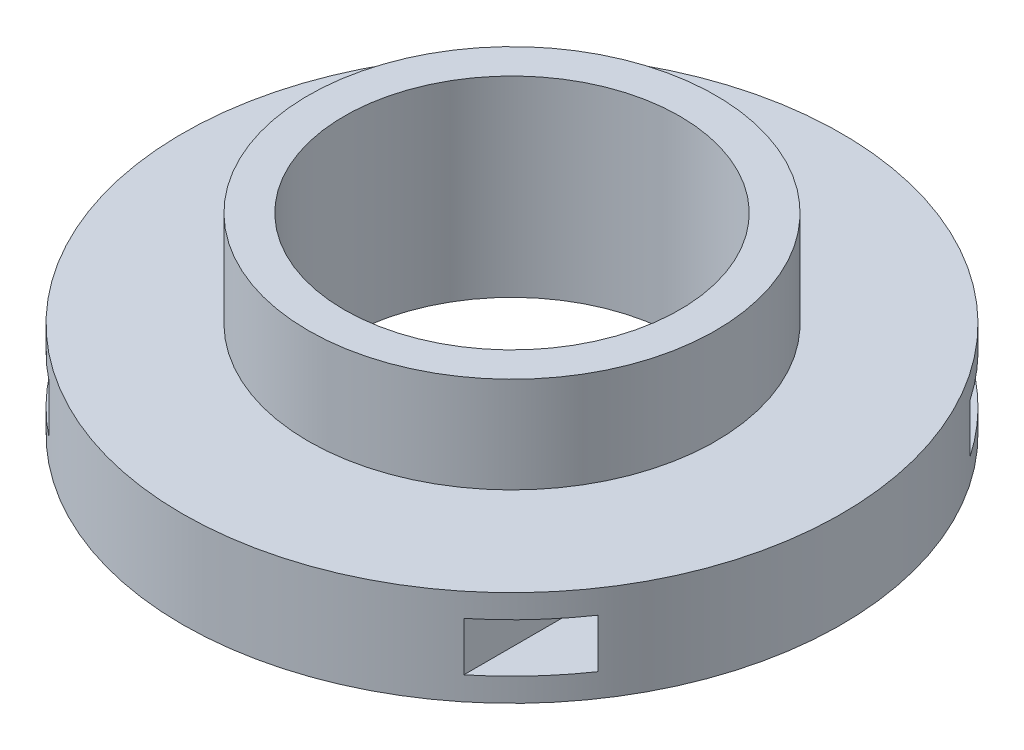
from build123d import *

# Parameters (mm, degrees)
SKETCH1_R               = 13.75
BOSS_EXTRUDE1_DEPTH     = 4
BOSS_EXTRUDE2_START     = 4
SKETCH5_R               = 8.5
BOSS_EXTRUDE2_DEPTH     = 4
CUT_EXTRUDE1_DEPTH      = 22.026768653
CUT_EXTRUDE1_DEPTH_BACK = 22.026768653
SKETCH6_W               = 2.888681075
SKETCH6_H               = 2.039823556
SKETCH6_W_2             = 2.682346713
SKETCH8_R               = 7
CUT_EXTRUDE3_DEPTH      = 12


with BuildPart() as part:
    # Sketch1 → Boss-Extrude1 (new body)
    with BuildSketch(Plane(origin=(0, 0, 0), x_dir=(1, 0, 0), z_dir=(0, 1, 0))):
        with Locations(Location((0, 0, 0), (0, 0, 270))):
            Circle(SKETCH1_R)
    extrude(amount=BOSS_EXTRUDE1_DEPTH)

    # Sketch5 → Boss-Extrude2 (add)
    with BuildSketch(Plane(origin=(0, 0, 0), x_dir=(1, 0, 0), z_dir=(0, 1, 0)).offset(BOSS_EXTRUDE2_START)):
        with Locations(Location((0, 0, 0), (0, 0, 270))):
            Circle(SKETCH5_R)
    extrude(amount=BOSS_EXTRUDE2_DEPTH)

    # Sketch6 → Cut-Extrude1 (cut, two sides: drawn at the far end of the back side and taken through both)
    with BuildSketch(Plane.XY.offset(-CUT_EXTRUDE1_DEPTH_BACK)):
        with Locations((-9.95563299, 2)):
            Rectangle(SKETCH6_W, SKETCH6_H)
        with Locations((10.007216581, 2)):
            Rectangle(SKETCH6_W_2, SKETCH6_H)
    extrude(amount=CUT_EXTRUDE1_DEPTH + CUT_EXTRUDE1_DEPTH_BACK, mode=Mode.SUBTRACT)

    # Sketch8 → Cut-Extrude3 (cut)
    with BuildSketch(Plane(origin=(0, 0, 0), x_dir=(1, 0, 0), z_dir=(0, 1, 0))):
        with Locations(Location((0, 0, 0), (0, 0, 270))):
            Circle(SKETCH8_R)
    extrude(amount=CUT_EXTRUDE3_DEPTH, mode=Mode.SUBTRACT)


solid = part.part
